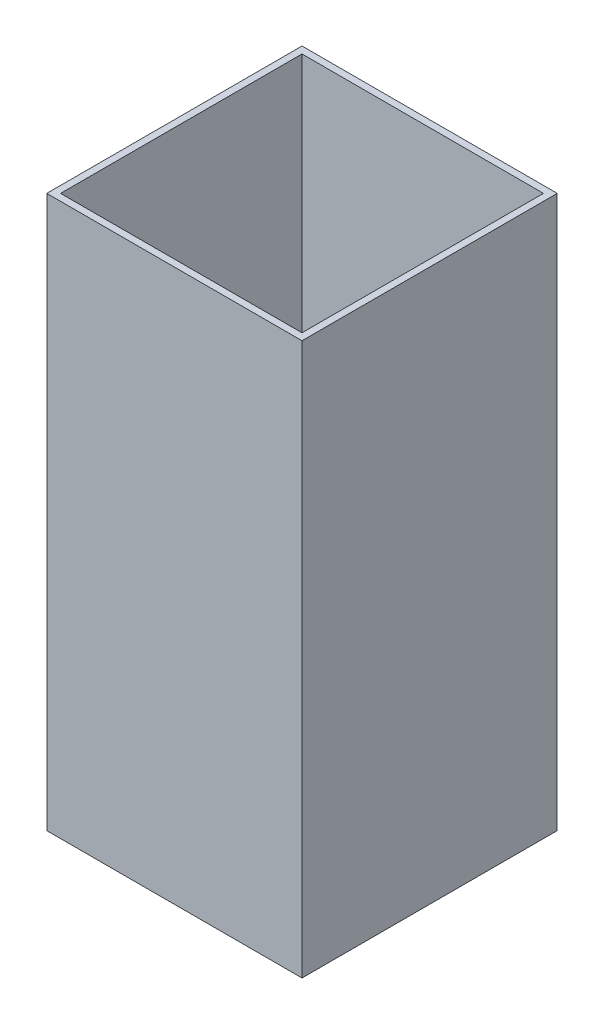
from build123d import *

# Parameters (mm, degrees)
SKETCH1_W           = 370
SKETCH1_H           = 370
SKETCH1_W_2         = 350
SKETCH1_H_2         = 350
BOSS_EXTRUDE1_DEPTH = 800


with BuildPart() as part:
    # Sketch1 → Boss-Extrude1 (new body)
    with BuildSketch(Plane(origin=(0, 0, 0), x_dir=(1, 0, 0), z_dir=(0, 1, 0))):
        Rectangle(SKETCH1_W, SKETCH1_H)
        Rectangle(SKETCH1_W_2, SKETCH1_H_2, mode=Mode.SUBTRACT)
    extrude(amount=BOSS_EXTRUDE1_DEPTH)


solid = part.part
